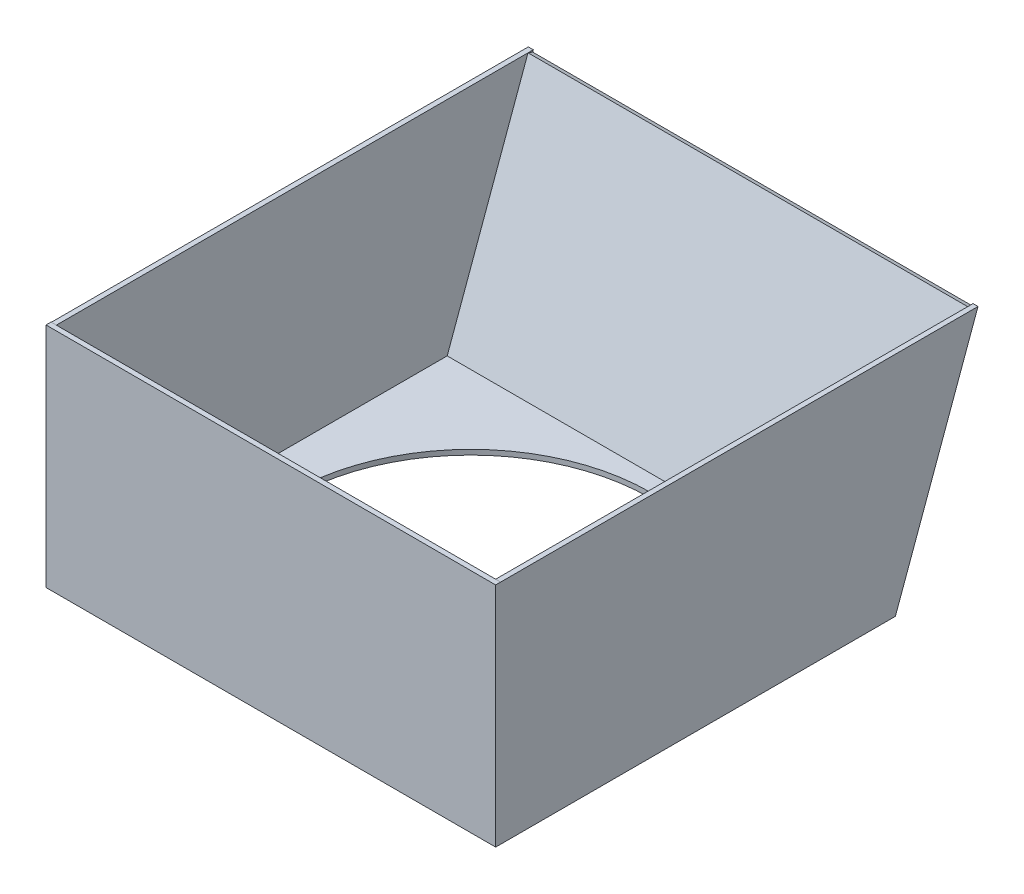
from build123d import *

# Parameters (mm, degrees)
SKETCH_1_W       = 225
SKETCH_1_H       = 200
SKETCH_1_R       = 90
EXTRUDE_1_DEPTH  = 2.5
SKETCH_9_W       = 225
SKETCH_9_H       = 120
EXTRUDE_11_DEPTH = 2.5
EXTRUDE_12_DEPTH = 2.5
EXTRUDE_13_DEPTH = 2.5
EXTRUDE_14_DEPTH = 2.5


with BuildPart() as part:
    # 草图1 → 凸台-拉伸1 (new body)
    with BuildSketch(Plane(origin=(0, 0, 0), x_dir=(1, 0, 0), z_dir=(0, 1, 0))):
        Rectangle(SKETCH_1_W, SKETCH_1_H)
        with Locations(Location((0, 0, 0), (0, 0, 270))):
            Circle(SKETCH_1_R, mode=Mode.SUBTRACT)
    extrude(amount=EXTRUDE_1_DEPTH)

    # 草图9 → 凸台-拉伸11 (add)
    with BuildSketch(Plane(origin=(0, -32.139380484, -88.302222156), x_dir=(1, 0, 0), z_dir=(0, 0.3420201433256658, 0.9396926207859095))):
        with Locations((0, 94.202014333)):
            Rectangle(SKETCH_9_W, SKETCH_9_H)
    extrude(amount=EXTRUDE_11_DEPTH)

    # 草图12 → 凸台-拉伸12 (add)
    with BuildSketch(Plane.ZY.offset(112.5)):
        Polygon((-100, 0), (-141.353630078, 113.618164853), (100, 113.618164853), (100, 0), align=None)
    extrude(amount=-EXTRUDE_12_DEPTH)

    # 草图13 → 凸台-拉伸13 (add)
    with BuildSketch(Plane(origin=(112.5, 0, 0), x_dir=(0, 0, -1), z_dir=(1, 0, 0))):
        Polygon((100, 0), (141.353630078, 113.618164853), (-100, 113.618164853), (-100, 0), align=None)
    extrude(amount=-EXTRUDE_13_DEPTH)

    # 草图15 → 凸台-拉伸14 (add)
    with BuildSketch(Plane.XY.offset(100)):
        Polygon((-112.5, 0), (-112.5, 113.791515023), (112.5, 113.618164853), (112.5, 0), align=None)
    extrude(amount=-EXTRUDE_14_DEPTH)


solid = part.part
